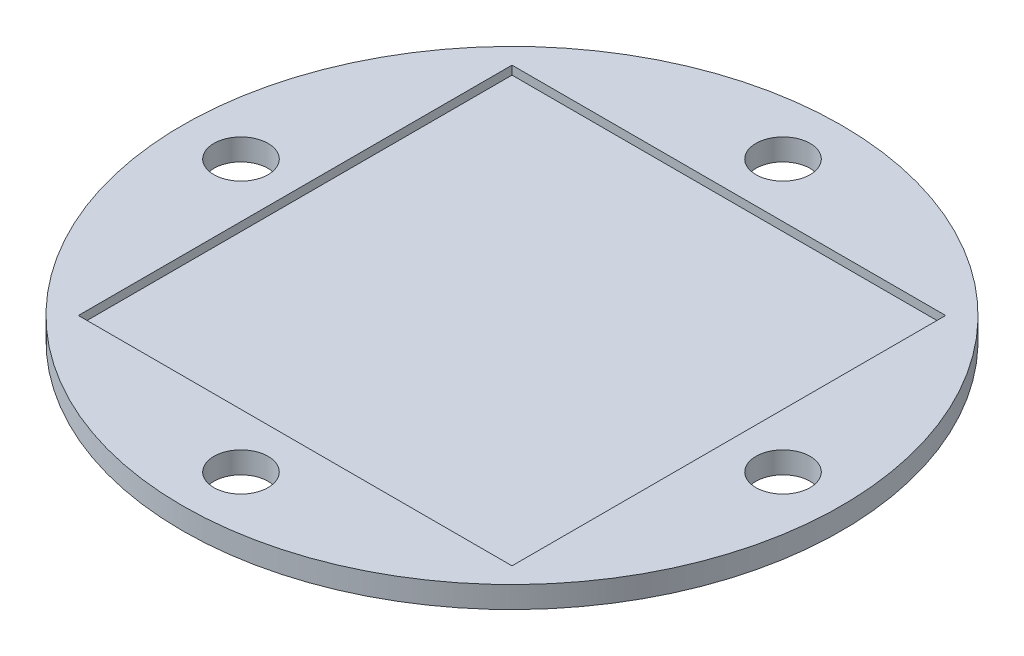
from build123d import *

# Parameters (mm, degrees)
SKETCH1_R           = 76
SKETCH1_W           = 100
SKETCH1_H           = 100
BOSS_EXTRUDE1_DEPTH = 5
SKETCH3_W           = 100
SKETCH3_H           = 100
BOSS_EXTRUDE2_DEPTH = 5
SKETCH3_2_W         = 100
SKETCH3_2_H         = 100
CUT_EXTRUDE1_DEPTH  = 2
SKETCH6_R           = 6.25
CUT_EXTRUDE2_DEPTH  = 10


with BuildPart() as part:
    # Sketch1 → Boss-Extrude1 (new body)
    with BuildSketch(Plane(origin=(0, 0, 0), x_dir=(1, 0, 0), z_dir=(0, 1, 0))):
        Circle(SKETCH1_R)
        Rectangle(SKETCH1_W, SKETCH1_H, mode=Mode.SUBTRACT)
    extrude(amount=BOSS_EXTRUDE1_DEPTH)

    # Sketch3 → Boss-Extrude2 (add)
    with BuildSketch(Plane(origin=(0, 5, 0), x_dir=(1, 0, 0), z_dir=(0, 1, 0))):
        Rectangle(SKETCH3_W, SKETCH3_H)
    extrude(amount=-BOSS_EXTRUDE2_DEPTH)

    # Sketch3<2> → Cut-Extrude1 (cut)
    with BuildSketch(Plane(origin=(0, 5, 0), x_dir=(1, 0, 0), z_dir=(0, 1, 0))):
        Rectangle(SKETCH3_2_W, SKETCH3_2_H)
    extrude(amount=-CUT_EXTRUDE1_DEPTH, mode=Mode.SUBTRACT)

    # Sketch6 → Cut-Extrude2 (cut)
    with BuildSketch(Plane(origin=(0, 5, 0), x_dir=(1, 0, 0), z_dir=(0, 1, 0))):
        with Locations((0, 62.5)):
            Circle(SKETCH6_R)
        with Locations((62.5, 0)):
            Circle(SKETCH6_R)
        with Locations((0, -62.5)):
            Circle(SKETCH6_R)
        with Locations((-62.5, 0)):
            Circle(SKETCH6_R)
    extrude(amount=-CUT_EXTRUDE2_DEPTH, mode=Mode.SUBTRACT)


solid = part.part
